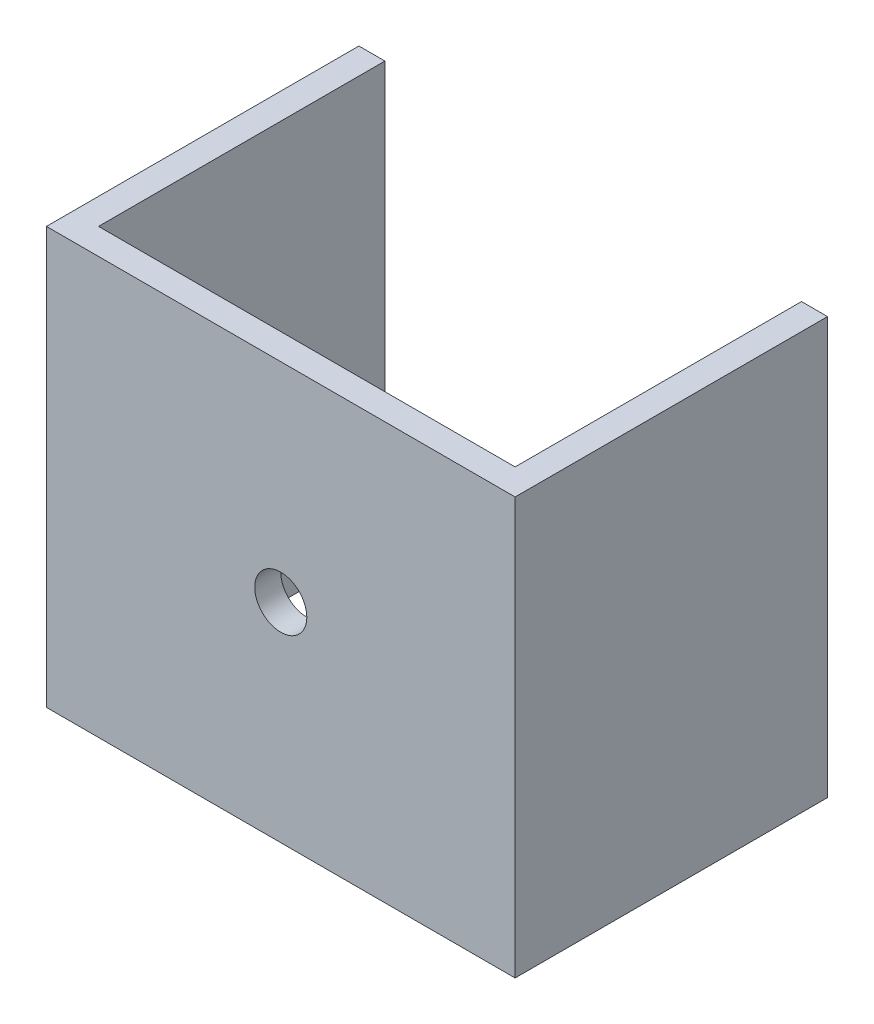
from build123d import *

# Parameters (mm, degrees)
BOSS_EXTRUDE1_DEPTH = 50.8
SKETCH2_R           = 3.175
CUT_EXTRUDE1_DEPTH  = 86.430512699


with BuildPart() as part:
    # Sketch1 → Boss-Extrude1 (new body)
    with BuildSketch(Plane(origin=(0, 0, 0), x_dir=(1, 0, 0), z_dir=(0, 1, 0))):
        Polygon((53.975, 38.1), (57.15, 38.1), (57.15, 0), (0, 0), (0, 38.1), (3.175, 38.1), (3.175, 3.175), (53.975, 3.175), align=None)
    extrude(amount=BOSS_EXTRUDE1_DEPTH)

    # Sketch2 → Cut-Extrude1 (cut, through all)
    with BuildSketch(Plane.XY):
        with Locations((28.575, 25.4)):
            Circle(SKETCH2_R)
    extrude(amount=-CUT_EXTRUDE1_DEPTH, mode=Mode.SUBTRACT)


solid = part.part
